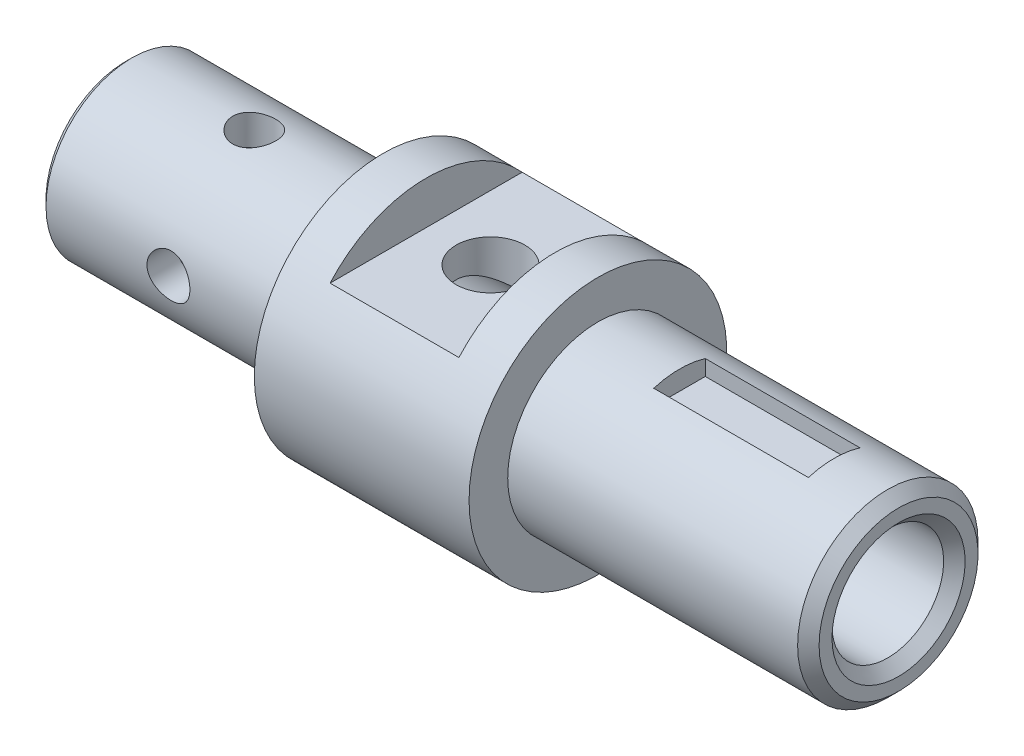
from build123d import *

# Parameters (mm, degrees)
CUT_EXTRUDE_1_DEPTH      = 185.932420089
CUT_EXTRUDE_1_DEPTH_BACK = 185.932420089
SKETCH_2_W               = 30
SKETCH_2_H               = 10
CUT_EXTRUDE_2_DEPTH      = 185.932420089
CUT_EXTRUDE_2_DEPTH_BACK = 185.932420089
SKETCH_3_R               = 5
SKETCH_3_R_2             = 8
CUT_EXTRUDE_3_DEPTH      = 185.932420219
CUT_EXTRUDE_3_DEPTH_BACK = 185.932420219
SKETCH_5_R               = 5
SKETCH_6_W               = 36
SKETCH_6_H               = 4.5
CUT_EXTRUDE_4_DEPTH      = 6
CHAMFER_1_SIZE           = 1.5
CHAMFER_2_SIZE           = 2.5


with BuildPart() as part:
    # Эскиз1 → Повернуть1 (revolve)
    with BuildSketch(Plane.XY, mode=Mode.PRIVATE) as revolve_1_sk:
        Polygon((0, 13), (0, 20), (60, 20), (60, 30), (110, 30), (110, 21), (180, 21), (180, 13), align=None)
    revolve(revolve_1_sk.sketch.rotate(Axis((0, 0, 0), (1, 0, 0)), 90), axis=Axis((0, 0, 0), (1, 0, 0)))

    # Эскиз2 → Вырез-Вытянуть1 (cut, two sides: drawn at the far end of the back side and taken through both)
    with BuildSketch(Plane.XY.offset(-CUT_EXTRUDE_1_DEPTH_BACK)):
        with Locations((85, 25)):
            Rectangle(SKETCH_2_W, SKETCH_2_H)
    extrude(amount=CUT_EXTRUDE_1_DEPTH + CUT_EXTRUDE_1_DEPTH_BACK, mode=Mode.SUBTRACT)

    # Эскиз3 → Вырез-Вытянуть2 (cut, two sides: drawn at the far end of the back side and taken through both)
    with BuildSketch(Plane(origin=(0, 0, 0), x_dir=(1, 0, 0), z_dir=(0, 1, 0)).offset(-CUT_EXTRUDE_2_DEPTH_BACK)):
        with Locations(Location((30, 0, 0), (0, 0, 270))):
            Circle(SKETCH_3_R)
        with Locations(Location((85, 0, 0), (0, 0, 270))):
            Circle(SKETCH_3_R_2)
    extrude(amount=CUT_EXTRUDE_2_DEPTH + CUT_EXTRUDE_2_DEPTH_BACK, mode=Mode.SUBTRACT)

    # Эскиз5 → Вырез-Вытянуть3 (cut, two sides: drawn at the far end of the back side and taken through both)
    with BuildSketch(Plane.XY.offset(-CUT_EXTRUDE_3_DEPTH_BACK)):
        with Locations((30, 0)):
            Circle(SKETCH_5_R)
    extrude(amount=CUT_EXTRUDE_3_DEPTH + CUT_EXTRUDE_3_DEPTH_BACK, mode=Mode.SUBTRACT)

    # Эскиз6 → Вырез-Вытянуть4 (cut, symmetric)
    with BuildSketch(Plane.XY):
        with Locations((147, 18.75)):
            Rectangle(SKETCH_6_W, SKETCH_6_H)
    extrude(amount=CUT_EXTRUDE_4_DEPTH, both=True, mode=Mode.SUBTRACT)

    # Фаска1
    chamfer_1_edges = [part.edges().sort_by_distance(p)[0] for p in [
        (0, 0, -13),
        (0, 0, -20),
    ]]
    chamfer(chamfer_1_edges, length=CHAMFER_1_SIZE)

    # Фаска2
    chamfer_2_edges = [part.edges().sort_by_distance(p)[0] for p in [
        (180, 0, -13),
        (180, 0, -21),
    ]]
    chamfer(chamfer_2_edges, length=CHAMFER_2_SIZE)


solid = part.part
